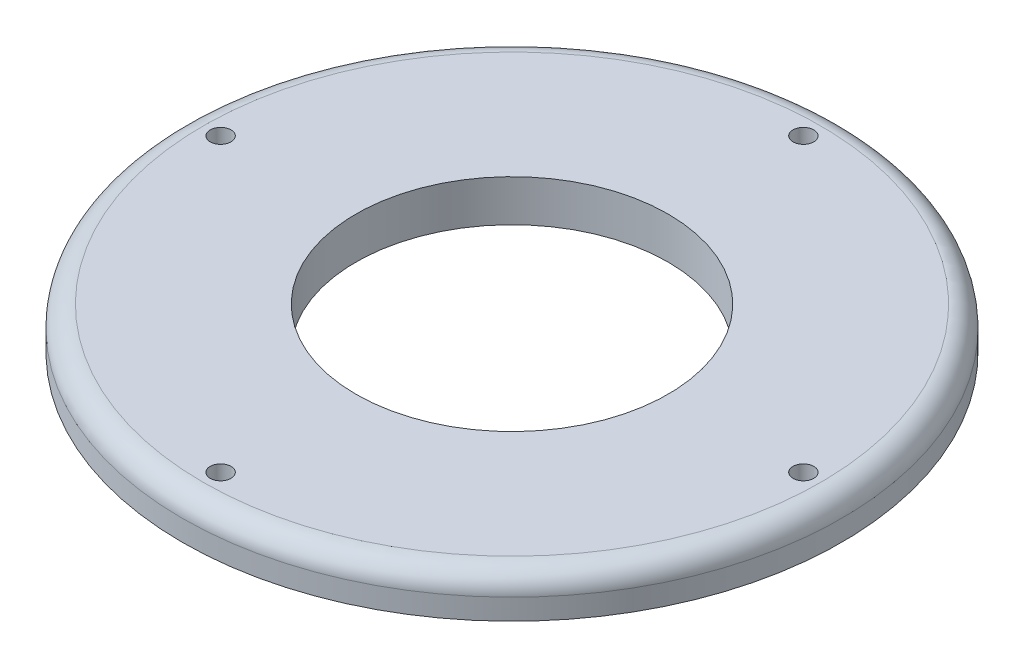
from build123d import *

# Parameters (mm, degrees)
SKETCH1_R           = 47.5
BOSS_EXTRUDE1_DEPTH = 6
SKETCH2_R           = 1.5
CUT_EXTRUDE1_DEPTH  = 68.44256816
SKETCH3_R           = 22.5
CUT_EXTRUDE2_DEPTH  = 68.44256816
FILLET1_R           = 3


with BuildPart() as part:
    # Sketch1 → Boss-Extrude1 (new body)
    with BuildSketch(Plane(origin=(0, 0, 0), x_dir=(1, 0, 0), z_dir=(0, 1, 0))):
        with Locations(Location((0, 0, 0), (0, 0, 270))):
            Circle(SKETCH1_R)
    extrude(amount=BOSS_EXTRUDE1_DEPTH)

    # Sketch2 → Cut-Extrude1 (cut, through all)
    with BuildSketch(Plane(origin=(0, 6, 0), x_dir=(1, 0, 0), z_dir=(0, 1, 0))):
        with Locations(Location((0, 42, 0), (0, 0, 270))):
            Circle(SKETCH2_R)
        with Locations(Location((42, 0, 0), (0, 0, 270))):
            Circle(SKETCH2_R)
        with Locations(Location((0, -42, 0), (0, 0, 270))):
            Circle(SKETCH2_R)
        with Locations(Location((-42, 0, 0), (0, 0, 270))):
            Circle(SKETCH2_R)
    extrude(amount=-CUT_EXTRUDE1_DEPTH, mode=Mode.SUBTRACT)

    # Sketch3 → Cut-Extrude2 (cut, through all)
    with BuildSketch(Plane(origin=(0, 6, 0), x_dir=(1, 0, 0), z_dir=(0, 1, 0))):
        with Locations(Location((0, 0, 0), (0, 0, 270))):
            Circle(SKETCH3_R)
    extrude(amount=-CUT_EXTRUDE2_DEPTH, mode=Mode.SUBTRACT)

    # Fillet1
    fillet1_edges = [part.edges().sort_by_distance(p)[0] for p in [
        (0, 6, -47.5),
    ]]
    fillet(fillet1_edges, radius=FILLET1_R)


solid = part.part
